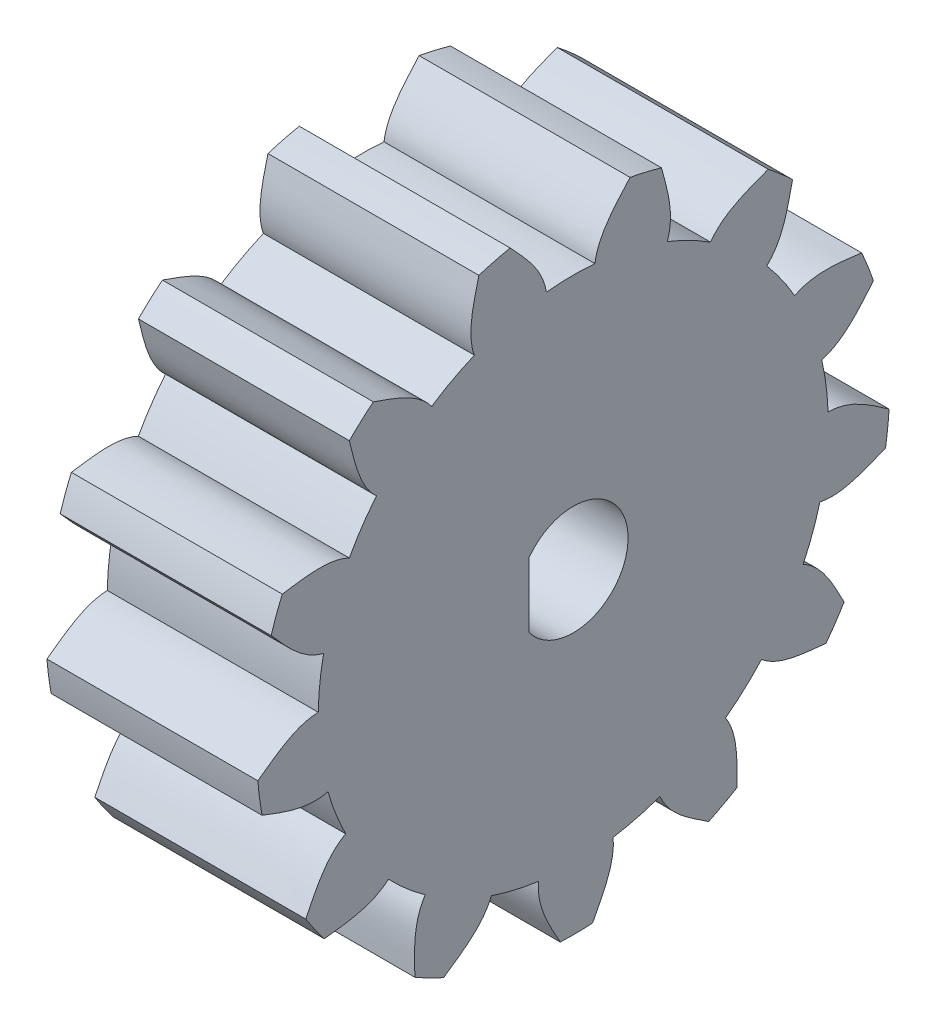
from build123d import *

# Parameters (mm, degrees)
SKETCH3_R           = 12.090863095
BOSS_EXTRUDE1_DEPTH = 10
BOSS_EXTRUDE2_DEPTH = 10
CIRPATTERN1_COUNT   = 13
CUT_EXTRUDE1_DEPTH  = 24.435008607


with BuildPart() as part:
    # Sketch3 → Boss-Extrude1 (new body)
    with BuildSketch(Plane.YZ):
        with Locations(Location((0, 0, 0), (0, 0, 270))):
            Circle(SKETCH3_R)
    extrude(amount=BOSS_EXTRUDE1_DEPTH)

    # Sketch4 → Boss-Extrude2 (add)
    with BuildSketch(Plane.YZ):
        with BuildLine():
            ThreePointArc((-1.195976025, 14.952245361), (-1.957892883, 14.871672921), (-2.714701737, 14.752301328))
            add(Edge.make_bspline(
                [(-2.714701737, 14.752301328), (-3.072545731, 13.791794486), (-3.565367762, 12.687541268), (-3.309213228, 11.62919078)],
                knots=[0.053106957, 0.053106957, 0.053106957, 0.053106957, 1.037972429, 1.037972429, 1.037972429, 1.037972429], degree=3))
            ThreePointArc((-3.309213228, 11.62919078), (-1.57817432, 11.987424085), (0.186598469, 12.089423121))
            add(Edge.make_bspline(
                [(-1.195976025, 14.952245361), (-0.601727805, 14.117083837), (0.160103486, 13.178008863), (0.186598469, 12.089423121)],
                knots=[0.053106957, 0.053106957, 0.053106957, 0.053106957, 1.037972429, 1.037972429, 1.037972429, 1.037972429], degree=3))
        make_face()
    boss_extrude2 = extrude(amount=BOSS_EXTRUDE2_DEPTH)

    # CirPattern1: Boss-Extrude2 ×13 about axis
    cirpattern1_axis = Axis((10, 0, 0), (1, 0, 0))
    for i in range(1, CIRPATTERN1_COUNT):
        add(boss_extrude2.rotate(cirpattern1_axis, i * 360 / CIRPATTERN1_COUNT))

    # Sketch5 → Cut-Extrude1 (cut, through all)
    with BuildSketch(Plane.YZ.offset(10)):
        with BuildLine():
            Line((-1.532970972, 2.1), (1.532970972, 2.1))
            ThreePointArc((1.532970972, 2.1), (0, -2.6), (-1.532970972, 2.1))
        make_face()
    extrude(amount=-CUT_EXTRUDE1_DEPTH, mode=Mode.SUBTRACT)


solid = part.part
